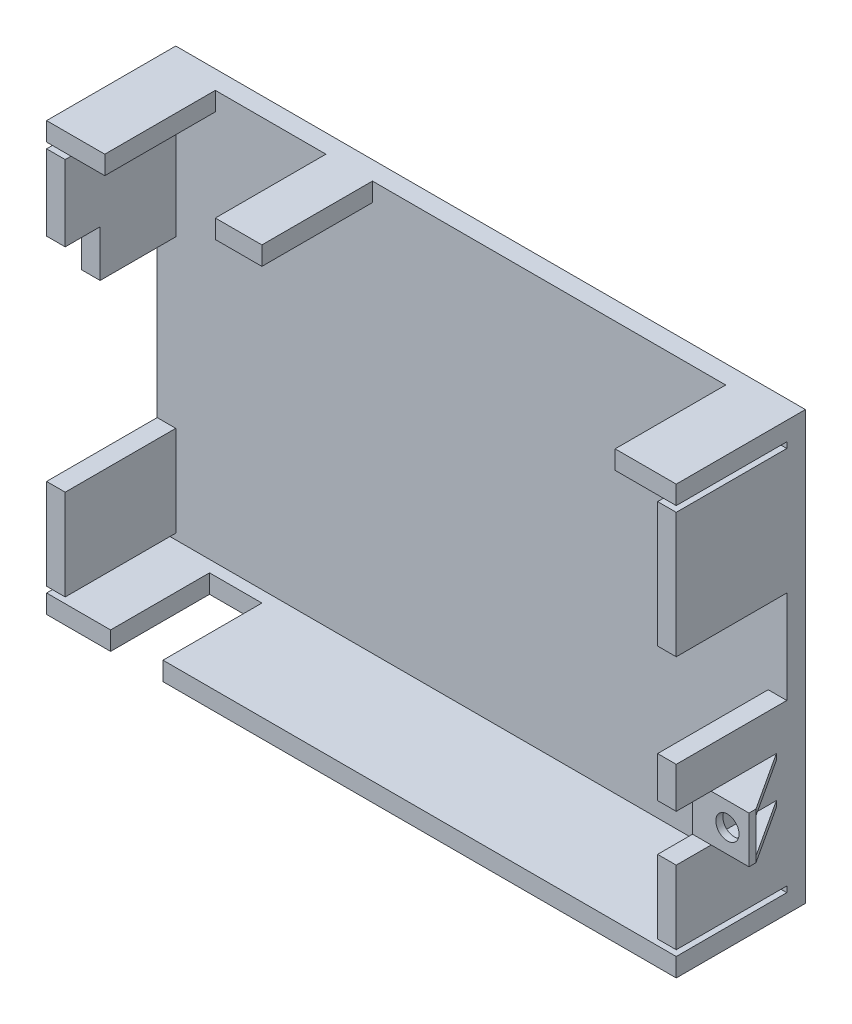
from build123d import *

# Parameters (mm, degrees)
SKETCH1_W           = 108.2
SKETCH1_H           = 73.5
BOSS_EXTRUDE2_DEPTH = 3.2
SKETCH2_W           = 108.2
SKETCH2_H           = 73.5
SKETCH2_W_2         = 101.8
SKETCH2_H_2         = 67.1
BOSS_EXTRUDE3_DEPTH = 19
SKETCH3_W           = 3.2
SKETCH3_H           = 1
CUT_EXTRUDE1_DEPTH  = 19
SKETCH4_W           = 3.2
SKETCH4_H           = 28.5
CUT_EXTRUDE2_DEPTH  = 19
SKETCH5_W           = 19
SKETCH5_H           = 3.2
SKETCH5_W_2         = 60.7
CUT_EXTRUDE3_DEPTH  = 19
SKETCH6_W           = 3.2
SKETCH6_H           = 16
CUT_EXTRUDE4_DEPTH  = 19
SKETCH7_W           = 9
SKETCH7_H           = 3.2
CUT_EXTRUDE5_DEPTH  = 17
CUT_EXTRUDE6_REACH  = 134.674
SKETCH8_W           = 6
SKETCH8_H           = 8
CUT_EXTRUDE7_REACH  = 134.674
SKETCH9_W           = 6
SKETCH9_H           = 8
SKETCH10_W          = 1.2
SKETCH10_H          = 8
BOSS_EXTRUDE4_DEPTH = 6.5
CUT_EXTRUDE8_REACH  = 139.052
SKETCH11_R          = 2
SKETCH12_W          = 6.5
SKETCH12_H          = 1
BOSS_EXTRUDE5_DEPTH = 10
CHAMFER1_SIZE       = 10
CHAMFER1_SIZE2      = 6.494075932


with BuildPart() as part:
    # Sketch1 → Boss-Extrude2 (new body)
    with BuildSketch(Plane.XY):
        with Locations((54.1, 36.75)):
            Rectangle(SKETCH1_W, SKETCH1_H)
    extrude(amount=BOSS_EXTRUDE2_DEPTH)

    # Sketch2 → Boss-Extrude3 (add)
    with BuildSketch(Plane.XY.offset(3.2)):
        with Locations((54.1, 36.75)):
            Rectangle(SKETCH2_W, SKETCH2_H)
        with Locations((54.1, 36.75)):
            Rectangle(SKETCH2_W_2, SKETCH2_H_2, mode=Mode.SUBTRACT)
    extrude(amount=BOSS_EXTRUDE3_DEPTH)

    # Sketch3 → Cut-Extrude1 (cut)
    with BuildSketch(Plane.XY.offset(22.2)):
        with Locations((1.6, 69.8)):
            Rectangle(SKETCH3_W, SKETCH3_H)
        with Locations((106.6, 69.8)):
            Rectangle(SKETCH3_W, SKETCH3_H)
        with Locations((106.6, 3.7)):
            Rectangle(SKETCH3_W, SKETCH3_H)
        with Locations((1.6, 3.7)):
            Rectangle(SKETCH3_W, SKETCH3_H)
    extrude(amount=-CUT_EXTRUDE1_DEPTH, mode=Mode.SUBTRACT)

    # Sketch4 → Cut-Extrude2 (cut)
    with BuildSketch(Plane.XY.offset(22.2)):
        with Locations((1.6, 34.05)):
            Rectangle(SKETCH4_W, SKETCH4_H)
    extrude(amount=-CUT_EXTRUDE2_DEPTH, mode=Mode.SUBTRACT)

    # Sketch5 → Cut-Extrude3 (cut)
    with BuildSketch(Plane.XY.offset(22.2)):
        with Locations((19.5, 71.9)):
            Rectangle(SKETCH5_W, SKETCH5_H)
        with Locations((67.35, 71.9)):
            Rectangle(SKETCH5_W_2, SKETCH5_H)
    extrude(amount=-CUT_EXTRUDE3_DEPTH, mode=Mode.SUBTRACT)

    # Sketch6 → Cut-Extrude4 (cut)
    with BuildSketch(Plane.XY.offset(22.2)):
        with Locations((106.6, 39.8)):
            Rectangle(SKETCH6_W, SKETCH6_H)
    extrude(amount=-CUT_EXTRUDE4_DEPTH, mode=Mode.SUBTRACT)

    # Sketch7 → Cut-Extrude5 (cut)
    with BuildSketch(Plane.XY.offset(22.2)):
        with Locations((15.5, 1.6)):
            Rectangle(SKETCH7_W, SKETCH7_H)
    extrude(amount=-CUT_EXTRUDE5_DEPTH, mode=Mode.SUBTRACT)

    # Sketch8 → Cut-Extrude6 (cut, up to next)
    with BuildSketch(Plane.ZY, mode=Mode.PRIVATE) as cut_extrude6_sk1:
        with Locations((19.2, 52.3)):
            Rectangle(SKETCH8_W, SKETCH8_H)
    cut_extrude6_tool1 = extrude(cut_extrude6_sk1.sketch, amount=-CUT_EXTRUDE6_REACH, mode=Mode.PRIVATE) & part.part
    add(cut_extrude6_tool1.solids().sort_by_distance((0, 52.3, 19.2))[0], mode=Mode.SUBTRACT)

    # Sketch9 → Cut-Extrude7 (cut, up to next)
    with BuildSketch(Plane(origin=(108.2, 0, 0), x_dir=(0, 0, -1), z_dir=(1, 0, 0)), mode=Mode.PRIVATE) as cut_extrude7_sk1:
        with Locations((-19.2, 20.8)):
            Rectangle(SKETCH9_W, SKETCH9_H)
    cut_extrude7_tool1 = extrude(cut_extrude7_sk1.sketch, amount=-CUT_EXTRUDE7_REACH, mode=Mode.PRIVATE) & part.part
    add(cut_extrude7_tool1.solids().sort_by_distance((108.2, 20.8, 19.2))[0], mode=Mode.SUBTRACT)

    # Sketch10 → Boss-Extrude4 (add)
    with BuildSketch(Plane(origin=(108.2, 0, 0), x_dir=(0, 0, -1), z_dir=(1, 0, 0))):
        with Locations((-15.6, 20.8)):
            Rectangle(SKETCH10_W, SKETCH10_H)
    extrude(amount=BOSS_EXTRUDE4_DEPTH)

    # Sketch11 → Cut-Extrude8 (cut, up to next)
    with BuildSketch(Plane(origin=(0, 0, 15), x_dir=(-1, 0, 0), z_dir=(0, 0, -1)), mode=Mode.PRIVATE) as cut_extrude8_sk1:
        with Locations(Location((-111, 20.8, 0), (0, 0, 90))):
            Circle(SKETCH11_R)
    cut_extrude8_tool1 = extrude(cut_extrude8_sk1.sketch, amount=-CUT_EXTRUDE8_REACH, mode=Mode.PRIVATE) & part.part
    add(cut_extrude8_tool1.solids().sort_by_distance((111, 20.8, 15))[0], mode=Mode.SUBTRACT)

    # Sketch12 → Boss-Extrude5 (add)
    with BuildSketch(Plane(origin=(0, 0, 15), x_dir=(-1, 0, 0), z_dir=(0, 0, -1))):
        with Locations((-111.45, 24.3)):
            Rectangle(SKETCH12_W, SKETCH12_H)
        with Locations((-111.45, 17.3)):
            Rectangle(SKETCH12_W, SKETCH12_H)
    extrude(amount=BOSS_EXTRUDE5_DEPTH)

    # Chamfer1
    chamfer1_edges = [part.edges().sort_by_distance(p)[0] for p in [
        (114.7, 17.3, 5),
        (114.7, 24.3, 5),
    ]]
    chamfer1_side = [part.faces().sort_by_distance(p)[0] for p in [
        (114.7, 20.8, 16.062362796),
    ]]
    chamfer(chamfer1_edges, length=CHAMFER1_SIZE, length2=CHAMFER1_SIZE2, reference=chamfer1_side[0])


solid = part.part
